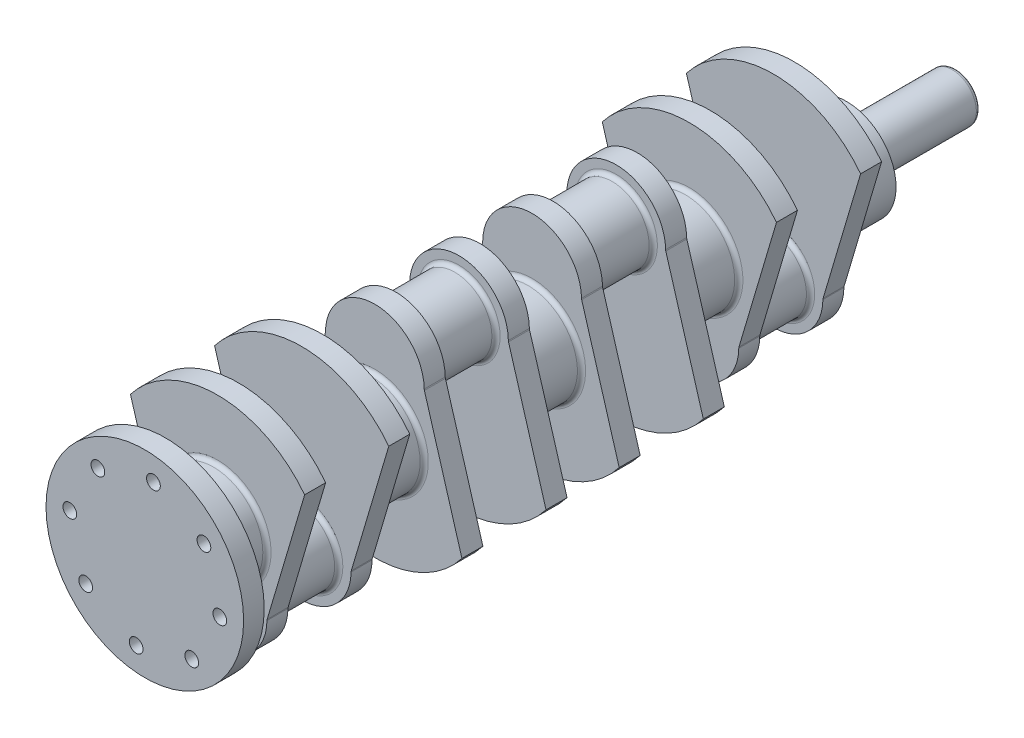
from build123d import *

# Parameters (mm, degrees)
BOSS_EXTRUDE1_DEPTH   = 15.300530819
SKETCH2_R             = 27
BOSS_EXTRUDE2_DEPTH   = 46
SKETCH3_R             = 36
BOSS_EXTRUDE3_DEPTH   = 38
BODY_MOVE_COPY3_ANGLE = 180
SKETCH4_R             = 17.5
BOSS_EXTRUDE4_DEPTH   = 80
SKETCH5_R             = 72
SKETCH5_R_2           = 5
BOSS_EXTRUDE6_DEPTH   = 15
FILLET1_R             = 3


with BuildPart() as part:
    # Sketch1 → Boss-Extrude1 (new body)
    with BuildSketch(Plane.XY):
        with BuildLine():
            Line((-63.461769721, 48.709380861), (-36, -44))
            ThreePointArc((-36, -44), (0, -80), (36, -44))
            Line((36, -44), (63.461769721, 48.709380861))
            ThreePointArc((63.461769721, 48.709380861), (0, 80), (-63.461769721, 48.709380861))
        make_face()
    boss_extrude1 = extrude(amount=BOSS_EXTRUDE1_DEPTH)

    # Sketch2 → Boss-Extrude2 (add)
    with BuildSketch(Plane.XY.offset(15.300530819)):
        with Locations((0, -44)):
            Circle(SKETCH2_R)
    extrude(amount=BOSS_EXTRUDE2_DEPTH)

    # Sketch3 → Boss-Extrude3 (add)
    with BuildSketch(Plane(origin=(0, 0, 0), x_dir=(-1, 0, 0), z_dir=(0, 0, -1))):
        Circle(SKETCH3_R)
    boss_extrude3 = extrude(amount=BOSS_EXTRUDE3_DEPTH)

    # Mirror1: Boss-Extrude1, Boss-Extrude3 across plane
    add(boss_extrude1.mirror(Plane.XY.offset(38.300530819)))
    add(boss_extrude3.mirror(Plane.XY.offset(38.300530819)))


with BuildPart() as body_2:
    # Mirror8: mirrored copy
    add(part.part.mirror(Plane.XY.offset(95.601061638)))


with BuildPart() as body_2_1:
    # Body-Move/Copy3: moved
    add(body_2.part.rotate(Axis((0, 0, 0), (0, 0, 1)), BODY_MOVE_COPY3_ANGLE))


with BuildPart() as body_3:
    # Mirror9: mirrored copy
    add(part.part.mirror(Plane.XY.offset(210.202123276)))

    # Sketch5 → Boss-Extrude6 (add)
    with BuildSketch(Plane.XY.offset(458.404246553)):
        Circle(SKETCH5_R)
        with Locations((6.28485214, 54.639734933)):
            Circle(SKETCH5_R_2, mode=Mode.SUBTRACT)
        with Locations((43.080188661, 34.192065526)):
            Circle(SKETCH5_R_2, mode=Mode.SUBTRACT)
        with Locations((54.639734933, -6.28485214)):
            Circle(SKETCH5_R_2, mode=Mode.SUBTRACT)
        with Locations((34.192065526, -43.080188661)):
            Circle(SKETCH5_R_2, mode=Mode.SUBTRACT)
        with Locations((-6.28485214, -54.639734933)):
            Circle(SKETCH5_R_2, mode=Mode.SUBTRACT)
        with Locations((-43.080188661, -34.192065526)):
            Circle(SKETCH5_R_2, mode=Mode.SUBTRACT)
        with Locations((-54.639734933, 6.28485214)):
            Circle(SKETCH5_R_2, mode=Mode.SUBTRACT)
        with Locations((-34.192065526, 43.080188661)):
            Circle(SKETCH5_R_2, mode=Mode.SUBTRACT)
    extrude(amount=BOSS_EXTRUDE6_DEPTH)


with BuildPart() as body_4:
    # Mirror9 2: mirrored copy
    add(body_2_1.part.mirror(Plane.XY.offset(210.202123276)))


with BuildPart() as part_1:
    add(part.part)

    # Sketch4 → Boss-Extrude4 (add)
    with BuildSketch(Plane(origin=(0, 0, -38), x_dir=(-1, 0, 0), z_dir=(0, 0, -1))):
        Circle(SKETCH4_R)
    extrude(amount=BOSS_EXTRUDE4_DEPTH)

    # Combine1: union body 2, body 4, body 3
    add(body_2_1.part)
    add(body_4.part)
    add(body_3.part)

    # Fillet1
    fillet1_edges = [part_1.edges().sort_by_distance(p)[0] for p in [
        (-27, -44, 15.300530819),
        (-27, -44, 61.300530819),
        (36, 0, 0),
        (36, -44, 68.950796229),
        (-36, -44, 68.950796229),
        (36, 0, 76.601061638),
        (17.5, 0, -38),
        (17.5, 0, -118),
        (36, 44, 183.551857867),
        (-36, 44, 183.551857867),
        (27, 44, 175.901592457),
        (-36, 0, 191.202123276),
        (27, 44, 129.901592457),
        (-36, 0, 229.202123276),
        (-36, 44, 122.251327048),
        (36, 44, 122.251327048),
        (36, 0, 114.601061638),
        (36, 44, 236.852388686),
        (-36, 44, 236.852388686),
        (27, 44, 244.502654096),
        (-36, 44, 298.152919505),
        (36, 44, 298.152919505),
        (27, 44, 290.502654096),
        (-36, 0, 305.803184915),
        (-36, 0, 343.803184915),
        (-36, -44, 412.753981143),
        (36, -44, 412.753981143),
        (-27, -44, 405.103715734),
        (36, 0, 420.404246553),
        (-27, -44, 359.103715734),
        (36, 0, 458.404246553),
        (36, -44, 351.453450324),
        (-36, -44, 351.453450324),
        (36, -44, 7.65026541),
        (-36, -44, 7.65026541),
    ]]
    fillet(fillet1_edges, radius=FILLET1_R)


solid = part_1.part
